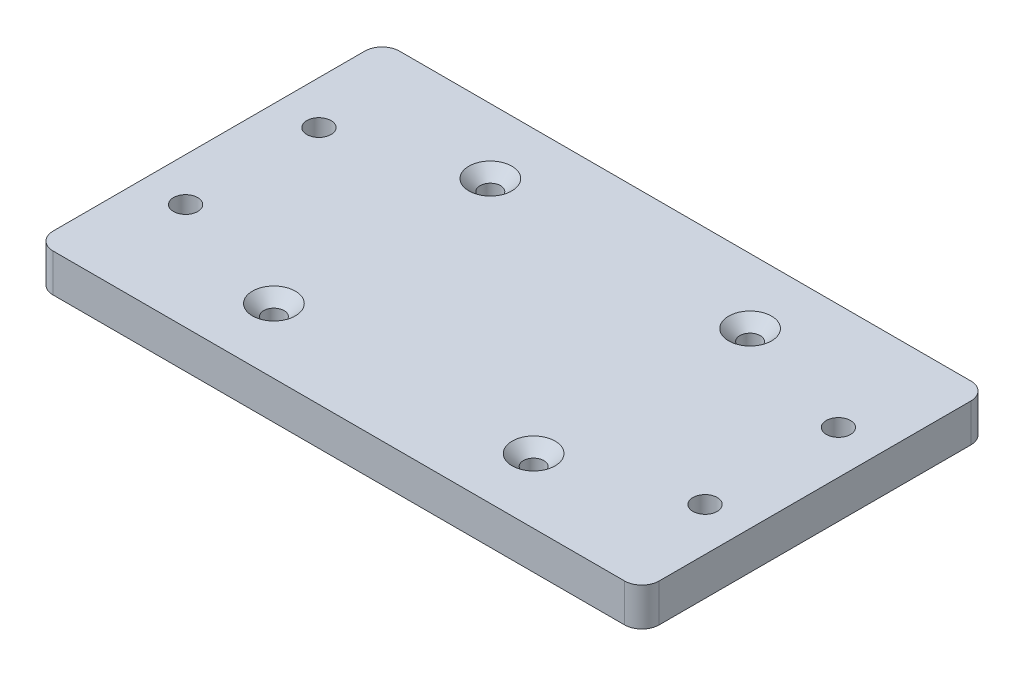
from build123d import *

# Parameters (mm, degrees)
SKETCH1_W           = 88.9
SKETCH1_H           = 50.8
BOSS_EXTRUDE1_DEPTH = 5.588
CUT_EXTRUDE1_REACH  = 53.499
SKETCH2_R           = 1.778
SKETCH2_R_2         = 1.5
FILLET1_R           = 2.54
CHAMFER1_SIZE       = 1.65


with BuildPart() as part:
    # Sketch1 → Boss-Extrude1 (new body)
    with BuildSketch(Plane(origin=(0, 0, 0), x_dir=(1, 0, 0), z_dir=(0, 1, 0))):
        Rectangle(SKETCH1_W, SKETCH1_H)
    extrude(amount=BOSS_EXTRUDE1_DEPTH)

    # Sketch2 → Cut-Extrude1 (cut, up to next)
    with BuildSketch(Plane(origin=(0, 5.588, 0), x_dir=(1, 0, 0), z_dir=(0, 1, 0)), mode=Mode.PRIVATE) as cut_extrude1_sk1:
        with Locations(Location((-38.1, -9.779, 0), (0, 0, 270))):
            Circle(SKETCH2_R)
    cut_extrude1_tool1 = extrude(cut_extrude1_sk1.sketch, amount=-CUT_EXTRUDE1_REACH, mode=Mode.PRIVATE) & part.part
    # Sketch2 → Cut-Extrude1 (cut, up to next)
    with BuildSketch(Plane(origin=(0, 5.588, 0), x_dir=(1, 0, 0), z_dir=(0, 1, 0)), mode=Mode.PRIVATE) as cut_extrude1_sk2:
        with Locations(Location((-38.1, 9.779, 0), (0, 0, 270))):
            Circle(SKETCH2_R)
    cut_extrude1_tool2 = extrude(cut_extrude1_sk2.sketch, amount=-CUT_EXTRUDE1_REACH, mode=Mode.PRIVATE) & part.part
    # Sketch2 → Cut-Extrude1 (cut, up to next)
    with BuildSketch(Plane(origin=(0, 5.588, 0), x_dir=(1, 0, 0), z_dir=(0, 1, 0)), mode=Mode.PRIVATE) as cut_extrude1_sk3:
        with Locations(Location((-19.05, -15.875, 0), (0, 0, 270))):
            Circle(SKETCH2_R_2)
    cut_extrude1_tool3 = extrude(cut_extrude1_sk3.sketch, amount=-CUT_EXTRUDE1_REACH, mode=Mode.PRIVATE) & part.part
    # Sketch2 → Cut-Extrude1 (cut, up to next)
    with BuildSketch(Plane(origin=(0, 5.588, 0), x_dir=(1, 0, 0), z_dir=(0, 1, 0)), mode=Mode.PRIVATE) as cut_extrude1_sk4:
        with Locations(Location((-19.05, 15.875, 0), (0, 0, 270))):
            Circle(SKETCH2_R_2)
    cut_extrude1_tool4 = extrude(cut_extrude1_sk4.sketch, amount=-CUT_EXTRUDE1_REACH, mode=Mode.PRIVATE) & part.part
    cut_extrude1_1 = cut_extrude1_tool1.solids().sort_by_distance((-38.1, 5.588, 9.779))[0]
    add(cut_extrude1_1, mode=Mode.SUBTRACT)
    cut_extrude1_2 = cut_extrude1_tool2.solids().sort_by_distance((-38.1, 5.588, -9.779))[0]
    add(cut_extrude1_2, mode=Mode.SUBTRACT)
    cut_extrude1_3 = cut_extrude1_tool3.solids().sort_by_distance((-19.05, 5.588, 15.875))[0]
    add(cut_extrude1_3, mode=Mode.SUBTRACT)
    cut_extrude1_4 = cut_extrude1_tool4.solids().sort_by_distance((-19.05, 5.588, -15.875))[0]
    add(cut_extrude1_4, mode=Mode.SUBTRACT)
    cut_extrude1 = cut_extrude1_1 + cut_extrude1_2 + cut_extrude1_3 + cut_extrude1_4  # Cut-Extrude1 as one shape, for the pattern or mirror that repeats it

    # Mirror1: Cut-Extrude1 across plane
    add(cut_extrude1.mirror(Plane(origin=(0, 0, 0), x_dir=(0, 0, 1), z_dir=(1, 0, 0))), mode=Mode.SUBTRACT)

    # Fillet1
    fillet1_edges = [part.edges().sort_by_distance(p)[0] for p in [
        (44.45, 2.794, 25.4),
        (-44.45, 2.794, 25.4),
        (-44.45, 2.794, -25.4),
        (44.45, 2.794, -25.4),
    ]]
    fillet(fillet1_edges, radius=FILLET1_R)

    # Chamfer1
    chamfer1_edges = [part.edges().sort_by_distance(p)[0] for p in [
        (-19.05, 5.588, -17.375),
        (-19.05, 5.588, 14.375),
        (19.05, 5.588, -17.375),
        (19.05, 5.588, 14.375),
    ]]
    chamfer(chamfer1_edges, length=CHAMFER1_SIZE)


solid = part.part
